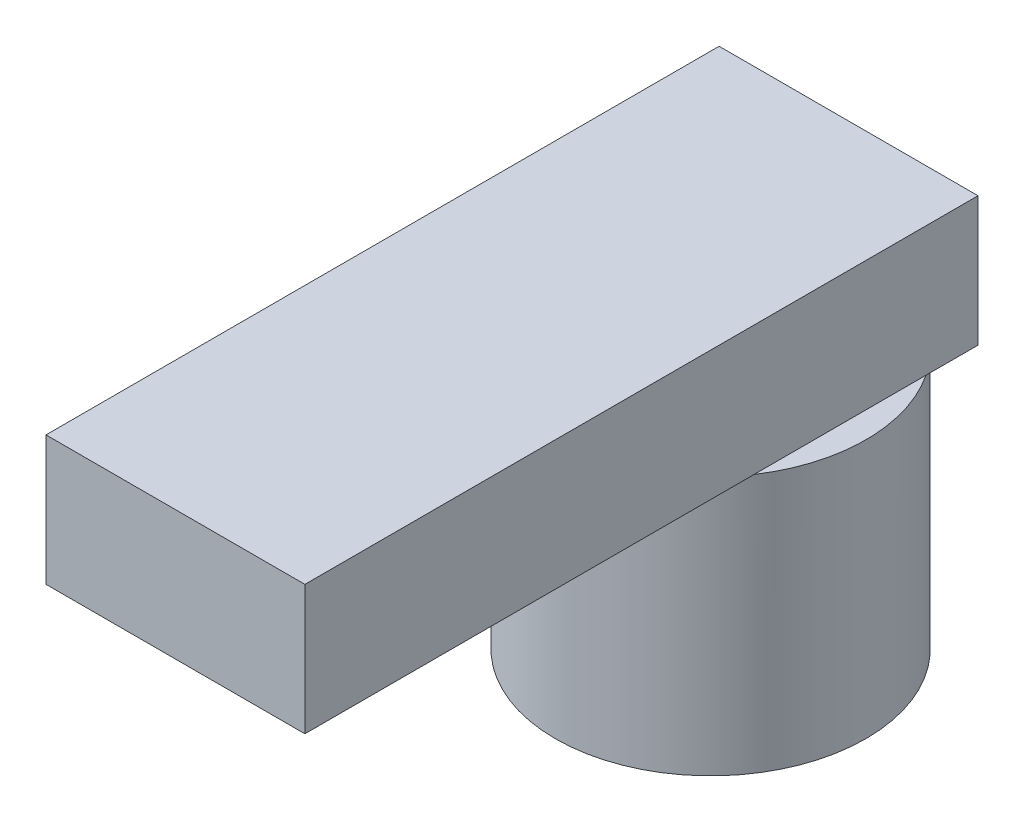
from build123d import *

# Parameters (mm, degrees)
SKETCH1_W           = 5
SKETCH1_H           = 13
BOSS_EXTRUDE1_DEPTH = 2.5
SKETCH2_R           = 3
BOSS_EXTRUDE2_DEPTH = 5


with BuildPart() as part:
    # Sketch1 → Boss-Extrude1 (new body)
    with BuildSketch(Plane(origin=(0, 0, 0), x_dir=(1, 0, 0), z_dir=(0, 1, 0))):
        with Locations((2.5, 6.5)):
            Rectangle(SKETCH1_W, SKETCH1_H)
    extrude(amount=BOSS_EXTRUDE1_DEPTH)

    # Sketch2 → Boss-Extrude2 (add)
    with BuildSketch(Plane(origin=(0, 0, 0), x_dir=(1, 0, 0), z_dir=(0, 1, 0))):
        with Locations(Location((2.5, 10.335729582, 0), (0, 0, 270))):
            Circle(SKETCH2_R)
    extrude(amount=-BOSS_EXTRUDE2_DEPTH)


solid = part.part
